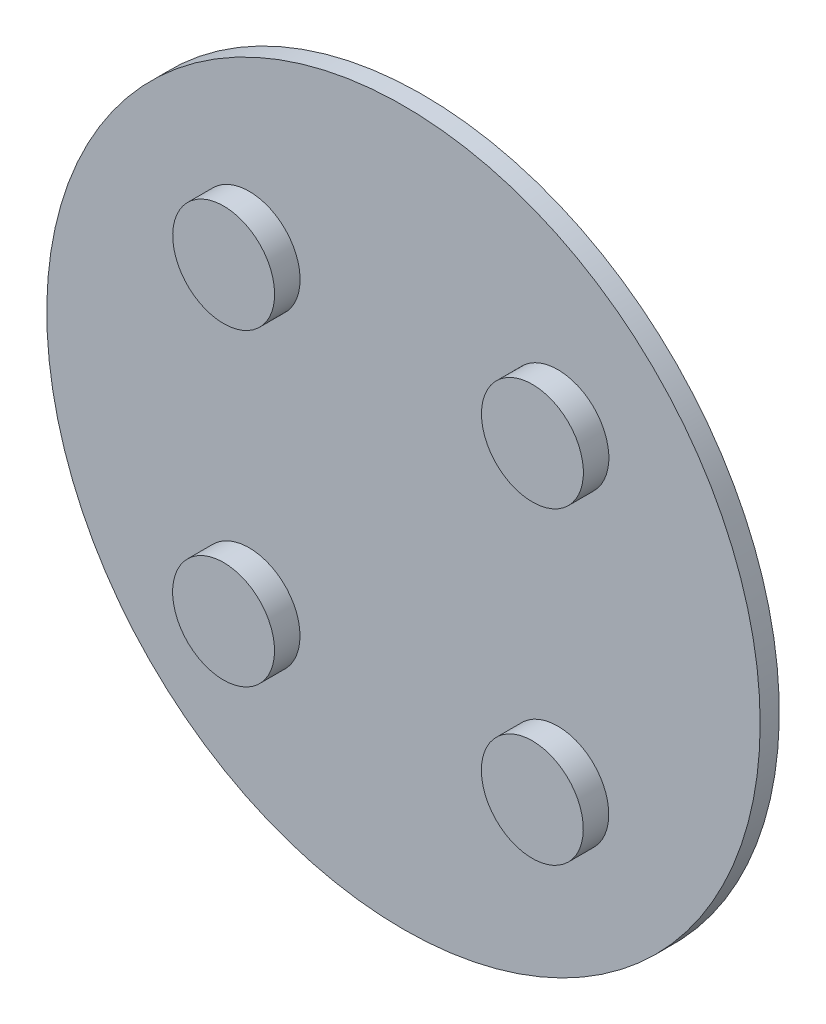
from build123d import *

# Parameters (mm, degrees)
SKETCH1_R           = 200
BOSS_EXTRUDE1_DEPTH = 15
SKETCH2_W           = 148.705267073
SKETCH2_H           = 49.968568036
BOSS_EXTRUDE2_DEPTH = 20
CUT_EXTRUDE2_DEPTH  = 103
SKETCH4_R           = 280
BOSS_EXTRUDE3_DEPTH = 15
SKETCH6_R           = 40
BOSS_EXTRUDE4_DEPTH = 20
CIRPATTERN1_COUNT   = 4
SKETCH7_W           = 152.434020428
SKETCH7_H           = 72.590976785
BOSS_EXTRUDE5_DEPTH = 5


with BuildPart() as part:
    # Sketch1 → Boss-Extrude1 (new body)
    with BuildSketch(Plane.XY):
        with Locations((-32.819152061, -16.939919955)):
            Circle(SKETCH1_R)
    extrude(amount=BOSS_EXTRUDE1_DEPTH)

    # Sketch2 → Boss-Extrude2 (add)
    with BuildSketch(Plane.XY.offset(15)):
        with Locations((-30.944542613, -22.016117064)):
            Rectangle(SKETCH2_W, SKETCH2_H)
    extrude(amount=BOSS_EXTRUDE2_DEPTH)

    # Sketch3 → Cut-Extrude2 (cut)
    with BuildSketch(Plane(origin=(0, 2.968166954, 0), x_dir=(1, 0, 0), z_dir=(0, 1, 0))):
        with BuildLine():
            ThreePointArc((-28.877479091, -22.677000866), (-44.602439558, -24.756660882), (-28.877479091, -26.836320898))
            ThreePointArc((-28.877479091, -26.836320898), (-13.152518624, -24.756660882), (-28.877479091, -22.677000866))
        make_face()
    extrude(amount=-CUT_EXTRUDE2_DEPTH, mode=Mode.SUBTRACT)

    # Sketch4 → Boss-Extrude3 (add)
    with BuildSketch(Plane.XY.offset(35)):
        with Locations((-32.819152061, -25.168448638)):
            Circle(SKETCH4_R)
    extrude(amount=BOSS_EXTRUDE3_DEPTH)

    # Sketch6 → Boss-Extrude4 (add)
    with BuildSketch(Plane.XY.offset(50)):
        with Locations((-154.032312031, -146.309301386)):
            Circle(SKETCH6_R)
    boss_extrude4 = extrude(amount=BOSS_EXTRUDE4_DEPTH)

    # CirPattern1: Boss-Extrude4 ×4 about axis
    cirpattern1_axis = Axis((-32.819152061, -25.168448638, 0), (0, 0, 1))
    for i in range(1, CIRPATTERN1_COUNT):
        add(boss_extrude4.rotate(cirpattern1_axis, i * 360 / CIRPATTERN1_COUNT))

    # Sketch7 → Boss-Extrude5 (add)
    with BuildSketch(Plane(origin=(0, 0, 35), x_dir=(-1, 0, 0), z_dir=(0, 0, -1))):
        with Locations((46.178823142, -254.15774716)):
            Rectangle(SKETCH7_W, SKETCH7_H)
    extrude(amount=BOSS_EXTRUDE5_DEPTH)


solid = part.part
